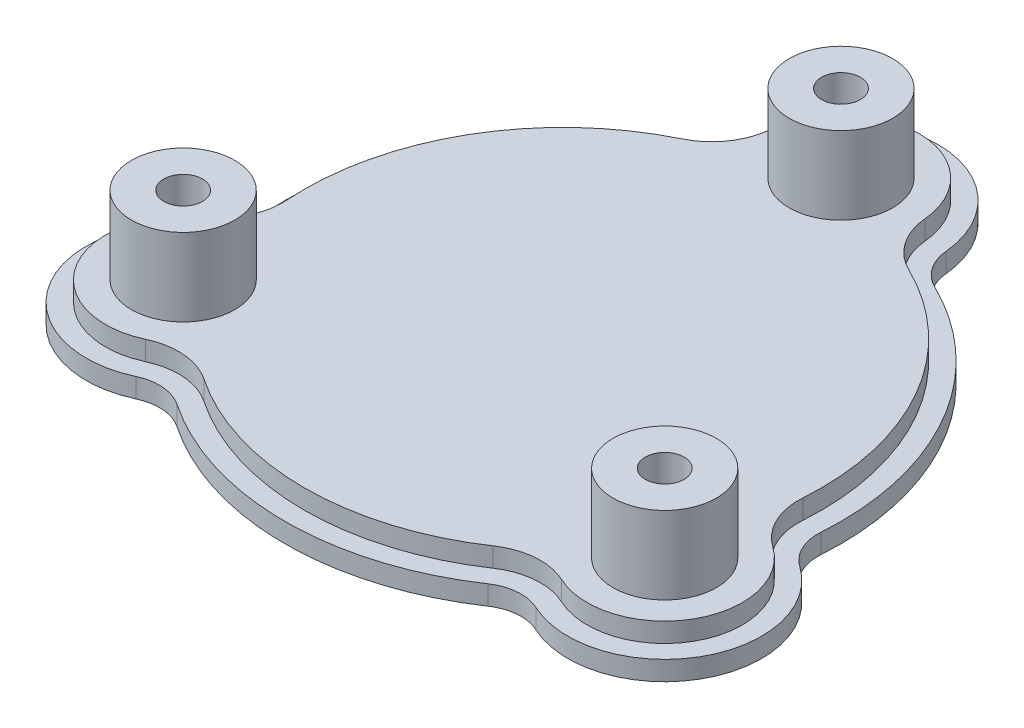
from build123d import *

# Parameters (mm, degrees)
SKETCH1_R           = 6
BOSS_EXTRUDE2_DEPTH = 3
SKETCH3_R           = 6
BOSS_EXTRUDE4_DEPTH = 3
SKETCH6_R           = 8
SKETCH6_R_2         = 6
BOSS_EXTRUDE6_DEPTH = 6
SKETCH7_R           = 8
SKETCH7_R_2         = 6
SKETCH7_R_3         = 3
BOSS_EXTRUDE7_DEPTH = 6


with BuildPart() as part:
    # Sketch1 → Boss-Extrude2 (new body)
    with BuildSketch(Plane(origin=(0, 0, 0), x_dir=(1, 0, 0), z_dir=(0, 1, 0))):
        with BuildLine():
            ThreePointArc((-18.846153454, 38.65), (-37.239092363, 21.5), (-42.894958583, -3.003752345))
            ThreePointArc((-42.894958583, -3.003752345), (-43.557934635, -6.502479184), (-45.856433127, -9.222319513))
            ThreePointArc((-45.856433127, -9.222319513), (-50.229473419, -29), (-30.914979544, -35.101676259))
            ThreePointArc((-30.914979544, -35.101676259), (-27.410279478, -34.471038339), (-24.048805129, -35.646247655))
            ThreePointArc((-24.048805129, -35.646247655), (0, -43), (24.048805129, -35.646247655))
            ThreePointArc((24.048805129, -35.646247655), (27.410279478, -34.471038339), (30.914979544, -35.101676259))
            ThreePointArc((30.914979544, -35.101676259), (50.229473419, -29), (45.856433127, -9.222319513))
            ThreePointArc((45.856433127, -9.222319513), (43.557934635, -6.502479184), (42.894958583, -3.003752345))
            ThreePointArc((42.894958583, -3.003752345), (37.239092363, 21.5), (18.846153454, 38.65))
            ThreePointArc((18.846153454, 38.65), (16.147655157, 40.973517523), (14.941453584, 44.323995772))
            ThreePointArc((14.941453584, 44.323995772), (0, 58), (-14.941453584, 44.323995772))
            ThreePointArc((-14.941453584, 44.323995772), (-16.147655157, 40.973517523), (-18.846153454, 38.65))
        make_face()
        with Locations(Location((0, 43, 0), (0, 0, 270))):
            Circle(SKETCH1_R, mode=Mode.SUBTRACT)
        with Locations(Location((37.239092363, -21.5, 0), (0, 0, 270))):
            Circle(SKETCH1_R, mode=Mode.SUBTRACT)
        with Locations(Location((-37.239092363, -21.5, 0), (0, 0, 270))):
            Circle(SKETCH1_R, mode=Mode.SUBTRACT)
    extrude(amount=BOSS_EXTRUDE2_DEPTH)

    # Sketch3 → Boss-Extrude4 (add)
    with BuildSketch(Plane(origin=(0, 3, 0), x_dir=(1, 0, 0), z_dir=(0, 1, 0))):
        with BuildLine():
            ThreePointArc((11.953162867, 44.059196617), (0, 55), (-11.953162867, 44.059196617))
            ThreePointArc((-11.953162867, 44.059196617), (-13.676307972, 39.272799119), (-17.531305538, 35.953488372))
            ThreePointArc((-17.531305538, 35.953488372), (-34.641016151, 20), (-39.902287054, -2.794188228))
            ThreePointArc((-39.902287054, -2.794188228), (-40.8493957, -7.792369426), (-44.132964974, -11.67785561))
            ThreePointArc((-44.132964974, -11.67785561), (-47.631397208, -27.5), (-32.179802107, -32.381341007))
            ThreePointArc((-32.179802107, -32.381341007), (-27.173087728, -31.480429693), (-22.370981516, -33.159300144))
            ThreePointArc((-22.370981516, -33.159300144), (0, -40), (22.370981516, -33.159300144))
            ThreePointArc((22.370981516, -33.159300144), (27.173087728, -31.480429693), (32.179802107, -32.381341007))
            ThreePointArc((32.179802107, -32.381341007), (47.631397208, -27.5), (44.132964974, -11.67785561))
            ThreePointArc((44.132964974, -11.67785561), (40.8493957, -7.792369426), (39.902287054, -2.794188228))
            ThreePointArc((39.902287054, -2.794188228), (34.641016151, 20), (17.531305538, 35.953488372))
            ThreePointArc((17.531305538, 35.953488372), (13.676307972, 39.272799119), (11.953162867, 44.059196617))
        make_face()
        with Locations(Location((37.239092363, -21.5, 0), (0, 0, 270))):
            Circle(SKETCH3_R, mode=Mode.SUBTRACT)
        with Locations(Location((-37.239092363, -21.5, 0), (0, 0, 270))):
            Circle(SKETCH3_R, mode=Mode.SUBTRACT)
        with Locations(Location((0, 43, 0), (0, 0, 270))):
            Circle(SKETCH3_R, mode=Mode.SUBTRACT)
    extrude(amount=BOSS_EXTRUDE4_DEPTH)

    # Sketch6 → Boss-Extrude6 (add)
    # profile 1 of 3: a face of its own
    with BuildSketch(Plane(origin=(0, 6, 0), x_dir=(1, 0, 0), z_dir=(0, 1, 0))):
        with Locations(Location((0, 43, 0), (0, 0, 270))):
            Circle(SKETCH6_R)
        with Locations(Location((0, 43, 0), (0, 0, 270))):
            Circle(SKETCH6_R_2, mode=Mode.SUBTRACT)
    # profile 2 of 3: a face of its own
    with BuildSketch(Plane(origin=(0, 6, 0), x_dir=(1, 0, 0), z_dir=(0, 1, 0))):
        with Locations(Location((-37.239092363, -21.5, 0), (0, 0, 270))):
            Circle(SKETCH6_R)
        with Locations(Location((-37.239092363, -21.5, 0), (0, 0, 270))):
            Circle(SKETCH6_R_2, mode=Mode.SUBTRACT)
    # profile 3 of 3: a face of its own
    with BuildSketch(Plane(origin=(0, 6, 0), x_dir=(1, 0, 0), z_dir=(0, 1, 0))):
        with Locations(Location((37.239092363, -21.5, 0), (0, 0, 270))):
            Circle(SKETCH6_R)
        with Locations(Location((37.239092363, -21.5, 0), (0, 0, 270))):
            Circle(SKETCH6_R_2, mode=Mode.SUBTRACT)
    extrude(amount=BOSS_EXTRUDE6_DEPTH)

    # Sketch7 → Boss-Extrude7 (add)
    # profile 1 of 6: a face of its own
    with BuildSketch(Plane(origin=(0, 12, 0), x_dir=(1, 0, 0), z_dir=(0, 1, 0))):
        with Locations(Location((0, 43, 0), (0, 0, 270))):
            Circle(SKETCH7_R)
        with Locations(Location((0, 43, 0), (0, 0, 270))):
            Circle(SKETCH7_R_2, mode=Mode.SUBTRACT)
    # profile 2 of 6: a face of its own
    with BuildSketch(Plane(origin=(0, 12, 0), x_dir=(1, 0, 0), z_dir=(0, 1, 0))):
        with Locations(Location((0, 43, 0), (0, 0, 270))):
            Circle(SKETCH7_R_2)
        with Locations(Location((0, 43, 0), (0, 0, 270))):
            Circle(SKETCH7_R_3, mode=Mode.SUBTRACT)
    # profile 3 of 6: a face of its own
    with BuildSketch(Plane(origin=(0, 12, 0), x_dir=(1, 0, 0), z_dir=(0, 1, 0))):
        with Locations(Location((-37.239092363, -21.5, 0), (0, 0, 270))):
            Circle(SKETCH7_R)
        with Locations(Location((-37.239092363, -21.5, 0), (0, 0, 270))):
            Circle(SKETCH7_R_2, mode=Mode.SUBTRACT)
    # profile 4 of 6: a face of its own
    with BuildSketch(Plane(origin=(0, 12, 0), x_dir=(1, 0, 0), z_dir=(0, 1, 0))):
        with Locations(Location((-37.239092363, -21.5, 0), (0, 0, 270))):
            Circle(SKETCH7_R_2)
        with Locations(Location((-37.239092363, -21.5, 0), (0, 0, 270))):
            Circle(SKETCH7_R_3, mode=Mode.SUBTRACT)
    # profile 5 of 6: a face of its own
    with BuildSketch(Plane(origin=(0, 12, 0), x_dir=(1, 0, 0), z_dir=(0, 1, 0))):
        with Locations(Location((37.239092363, -21.5, 0), (0, 0, 270))):
            Circle(SKETCH7_R)
        with Locations(Location((37.239092363, -21.5, 0), (0, 0, 270))):
            Circle(SKETCH7_R_2, mode=Mode.SUBTRACT)
    # profile 6 of 6: a face of its own
    with BuildSketch(Plane(origin=(0, 12, 0), x_dir=(1, 0, 0), z_dir=(0, 1, 0))):
        with Locations(Location((37.239092363, -21.5, 0), (0, 0, 270))):
            Circle(SKETCH7_R_2)
        with Locations(Location((37.239092363, -21.5, 0), (0, 0, 270))):
            Circle(SKETCH7_R_3, mode=Mode.SUBTRACT)
    extrude(amount=BOSS_EXTRUDE7_DEPTH)


solid = part.part
